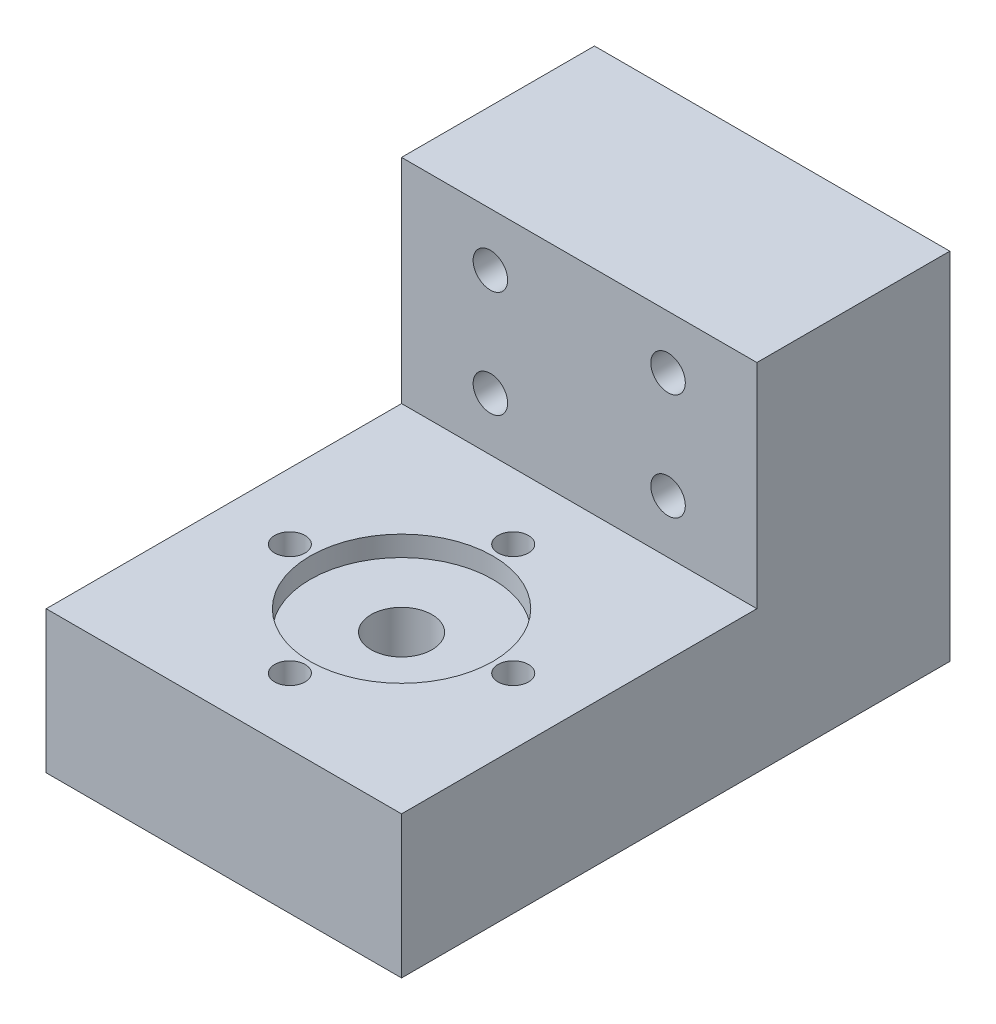
from build123d import *

# Parameters (mm, degrees)
SKETCH1_W           = 35
SKETCH1_H           = 35
BOSS_EXTRUDE1_DEPTH = 19
SKETCH2_W           = 35
SKETCH2_H           = 14
BOSS_EXTRUDE2_DEPTH = 35
SKETCH3_R           = 3
CUT_EXTRUDE1_DEPTH  = 68.690472003
SKETCH4_R           = 9
CUT_EXTRUDE2_DEPTH  = 2
SKETCH6_R           = 1.5
CUT_EXTRUDE3_DEPTH  = 68.690472003
SKETCH7_R           = 1.7
CUT_EXTRUDE4_DEPTH  = 61.621778265


with BuildPart() as part:
    # Sketch1 → Boss-Extrude1 (new body)
    with BuildSketch(Plane.XY):
        with Locations((17.5, 17.5)):
            Rectangle(SKETCH1_W, SKETCH1_H)
    extrude(amount=BOSS_EXTRUDE1_DEPTH)

    # Sketch2 → Boss-Extrude2 (add)
    with BuildSketch(Plane.XY.offset(19)):
        with Locations((17.5, 7)):
            Rectangle(SKETCH2_W, SKETCH2_H)
    extrude(amount=BOSS_EXTRUDE2_DEPTH)

    # Sketch3 → Cut-Extrude1 (cut, through all)
    with BuildSketch(Plane(origin=(0, 14, 0), x_dir=(1, 0, 0), z_dir=(0, 1, 0))):
        with Locations(Location((17.5, -36.5, 0), (0, 0, 270))):
            Circle(SKETCH3_R)
    extrude(amount=-CUT_EXTRUDE1_DEPTH, mode=Mode.SUBTRACT)

    # Sketch4 → Cut-Extrude2 (cut)
    with BuildSketch(Plane(origin=(0, 14, 0), x_dir=(1, 0, 0), z_dir=(0, 1, 0))):
        with Locations(Location((17.5, -36.5, 0), (0, 0, 270))):
            Circle(SKETCH4_R)
    extrude(amount=-CUT_EXTRUDE2_DEPTH, mode=Mode.SUBTRACT)

    # Sketch6 → Cut-Extrude3 (cut, through all)
    with BuildSketch(Plane(origin=(0, 14, 0), x_dir=(1, 0, 0), z_dir=(0, 1, 0))):
        with Locations(Location((6.5, -36.5, 0), (0, 0, 270))):
            Circle(SKETCH6_R)
        with Locations(Location((17.5, -25.5, 0), (0, 0, 270))):
            Circle(SKETCH6_R)
        with Locations(Location((28.5, -36.5, 0), (0, 0, 270))):
            Circle(SKETCH6_R)
        with Locations(Location((17.5, -47.5, 0), (0, 0, 270))):
            Circle(SKETCH6_R)
    extrude(amount=-CUT_EXTRUDE3_DEPTH, mode=Mode.SUBTRACT)

    # Sketch7 → Cut-Extrude4 (cut, through all)
    with BuildSketch(Plane.XY.offset(19)):
        with Locations((8.75, 29.75)):
            Circle(SKETCH7_R)
        with Locations((26.25, 29.75)):
            Circle(SKETCH7_R)
        with Locations((8.75, 19.25)):
            Circle(SKETCH7_R)
        with Locations((26.25, 19.25)):
            Circle(SKETCH7_R)
    extrude(amount=-CUT_EXTRUDE4_DEPTH, mode=Mode.SUBTRACT)


solid = part.part
